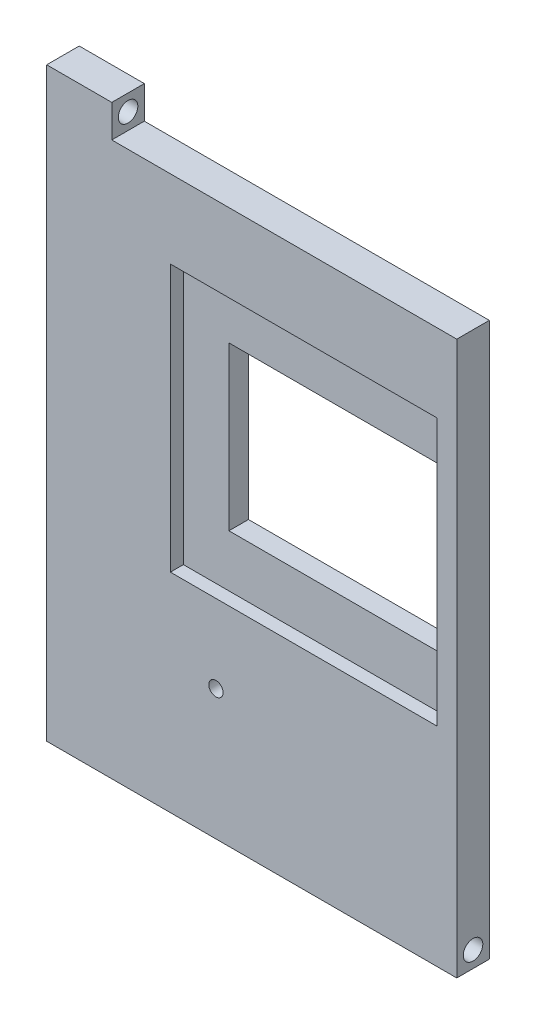
from build123d import *

# Parameters (mm, degrees)
BOSS_EXTRU_1_DEPTH       = 5
ESQUISSE8_W              = 34
ESQUISSE8_H              = 25
ENL_V_MAT_EXTRU_6_DEPTH  = 5
ENL_V_START              = -5
ESQUISSE9_W              = 41
ESQUISSE9_H              = 41
ENL_V_MAT_EXTRU_7_DEPTH  = 2
ENL_V_MAT_EXTRU_8_REACH  = 111.973
ESQUISSE10_R             = 1.5
ESQUISSE12_R             = 1.5
ENL_V_MAT_EXTRU_10_DEPTH = 15
ENL_V_MAT_EXTRU_11_REACH = 111.973
ESQUISSE6_R              = 1.1


with BuildPart() as part:
    # Esquisse1 → Boss.-Extru.1 (new body)
    with BuildSketch(Plane.XY):
        Polygon((0, 0), (0, 85), (0, 90), (10, 90), (10, 85), (63, 85), (63, 0), align=None)
    extrude(amount=BOSS_EXTRU_1_DEPTH)

    # Esquisse8 → Enlèv. mat.-Extru.6 (cut)
    with BuildSketch(Plane(origin=(0, 0, 0), x_dir=(-1, 0, 0), z_dir=(0, 0, -1))):
        with Locations((-43, 52.5)):
            Rectangle(ESQUISSE8_W, ESQUISSE8_H)
    extrude(amount=-ENL_V_MAT_EXTRU_6_DEPTH, mode=Mode.SUBTRACT)

    # Esquisse9 → Enlèv. mat.-Extru.7 (cut)
    with BuildSketch(Plane(origin=(0, 0, 0), x_dir=(-1, 0, 0), z_dir=(0, 0, -1)).offset(ENL_V_START)):
        with Locations((-39.5, 52.5)):
            Rectangle(ESQUISSE9_W, ESQUISSE9_H)
    extrude(amount=ENL_V_MAT_EXTRU_7_DEPTH, mode=Mode.SUBTRACT)

    # Esquisse10 → Enlèv. mat.-Extru.8 (cut, up to next)
    with BuildSketch(Plane.ZY, mode=Mode.PRIVATE) as enl_v_mat_extru_8_sk1:
        with Locations((2.5, 87.5)):
            Circle(ESQUISSE10_R)
    enl_v_mat_extru_8_tool1 = extrude(enl_v_mat_extru_8_sk1.sketch, amount=-ENL_V_MAT_EXTRU_8_REACH, mode=Mode.PRIVATE) & part.part
    add(enl_v_mat_extru_8_tool1.solids().sort_by_distance((0, 87.5, 2.5))[0], mode=Mode.SUBTRACT)

    # Esquisse12 → Enlèv. mat.-Extru.10 (cut)
    with BuildSketch(Plane(origin=(63, 0, 0), x_dir=(0, 0, -1), z_dir=(1, 0, 0))):
        with Locations((-2.5, 2.5)):
            Circle(ESQUISSE12_R)
    extrude(amount=-ENL_V_MAT_EXTRU_10_DEPTH, mode=Mode.SUBTRACT)

    # Esquisse6 → Enlèv. mat.-Extru.11 (cut, up to next)
    with BuildSketch(Plane(origin=(0, 0, 0), x_dir=(-1, 0, 0), z_dir=(0, 0, -1)), mode=Mode.PRIVATE) as enl_v_mat_extru_11_sk1:
        with Locations((-26, 20)):
            Circle(ESQUISSE6_R)
    enl_v_mat_extru_11_tool1 = extrude(enl_v_mat_extru_11_sk1.sketch, amount=-ENL_V_MAT_EXTRU_11_REACH, mode=Mode.PRIVATE) & part.part
    add(enl_v_mat_extru_11_tool1.solids().sort_by_distance((26, 20, 0))[0], mode=Mode.SUBTRACT)


solid = part.part
